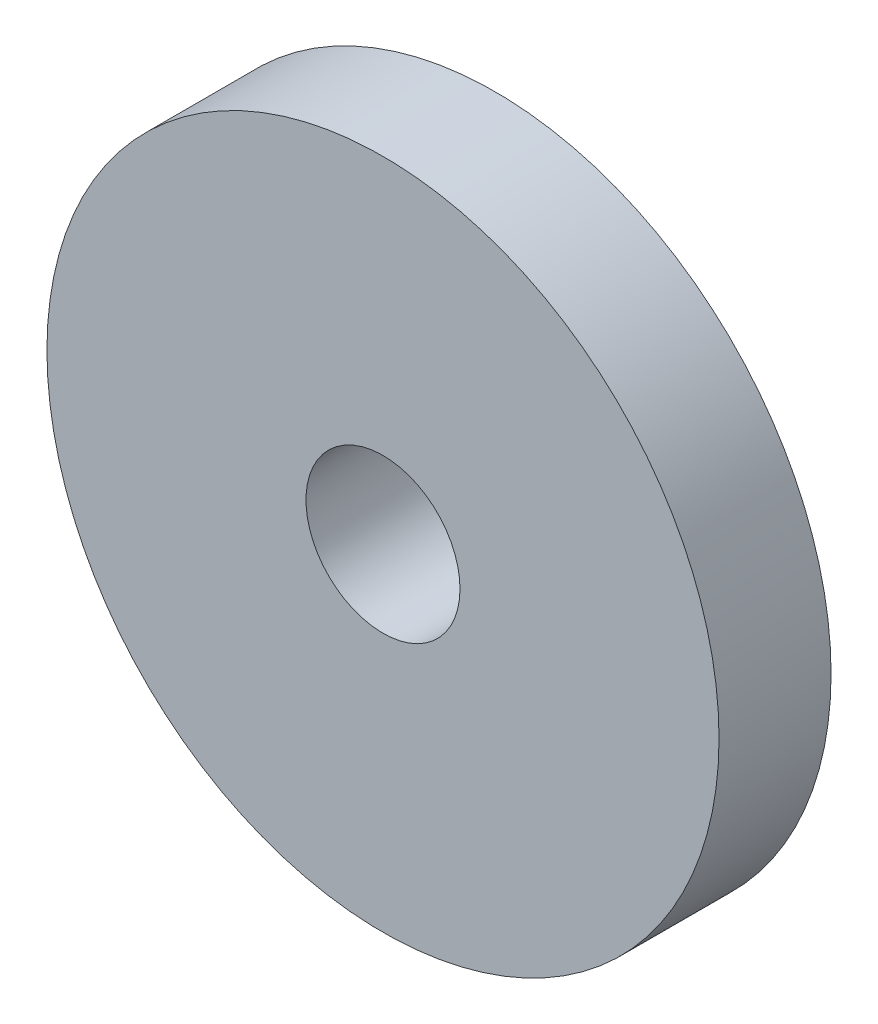
from build123d import *

# Parameters (mm, degrees)
SKETCH1_R           = 6
SKETCH1_R_2         = 1.375
BOSS_EXTRUDE1_DEPTH = 2


with BuildPart() as part:
    # Sketch1 → Boss-Extrude1 (new body)
    with BuildSketch(Plane.XY):
        Circle(SKETCH1_R)
        Circle(SKETCH1_R_2, mode=Mode.SUBTRACT)
    extrude(amount=BOSS_EXTRUDE1_DEPTH)


solid = part.part
